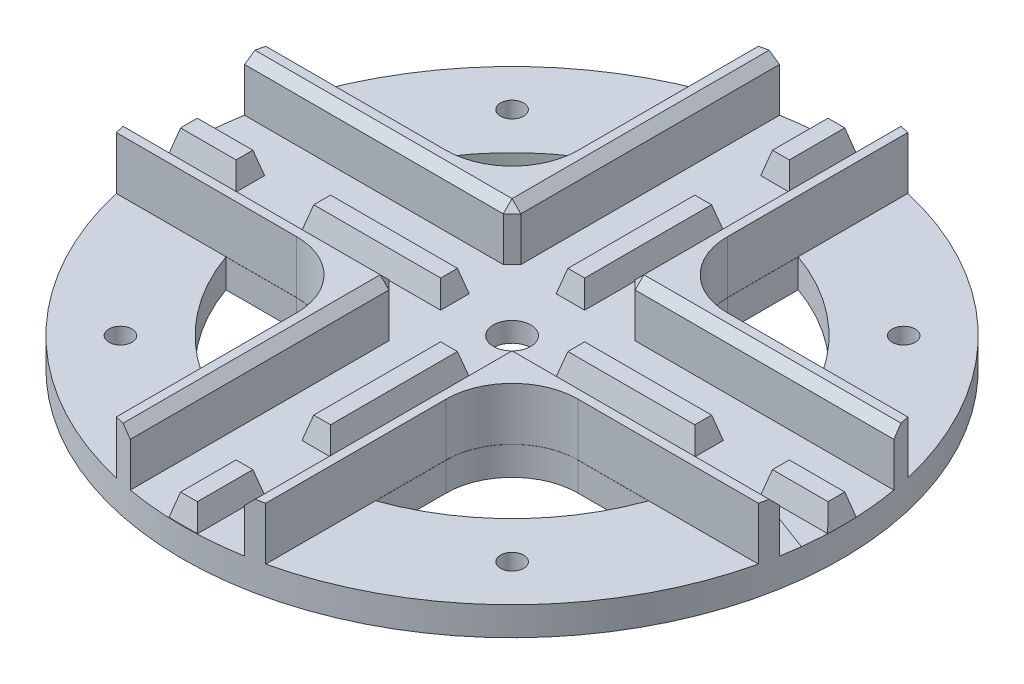
from build123d import *

# Parameters (mm, degrees)
SKETCH1_R                     = 75
SKETCH1_R_2                   = 4.25
BOSS_EXTRUDE1_DEPTH           = 6.5
BOSS_EXTRUDE2_DEPTH           = 12
CHAMFER1_SIZE                 = 2
CUT_EXTRUDE1_DEPTH            = 6.5
SKETCH4_R                     = 2.625
CUT_EXTRUDE2_DEPTH            = 6.5
SKETCH5_W                     = 31.547727215
SKETCH5_H                     = 6.5
BOSS_EXTRUDE3_DEPTH           = 5
BOSS_EXTRUDE3_DRAFT           = 15
BOSS_EXTRUDE3_PROFILE_2_DEPTH = 5
BOSS_EXTRUDE3_PROFILE_2_DRAFT = 15
SKETCH5_W_2                   = 6.5
SKETCH5_H_2                   = 31.547727215
BOSS_EXTRUDE3_PROFILE_3_DEPTH = 5
BOSS_EXTRUDE3_PROFILE_3_DRAFT = 15
BOSS_EXTRUDE3_PROFILE_4_DEPTH = 5
BOSS_EXTRUDE3_PROFILE_4_DRAFT = 15
BOSS_EXTRUDE3_PROFILE_5_DEPTH = 5
BOSS_EXTRUDE3_PROFILE_5_DRAFT = 15
BOSS_EXTRUDE3_PROFILE_6_DEPTH = 5
BOSS_EXTRUDE3_PROFILE_6_DRAFT = 15
BOSS_EXTRUDE3_PROFILE_7_DEPTH = 5
BOSS_EXTRUDE3_PROFILE_7_DRAFT = 15
BOSS_EXTRUDE3_PROFILE_8_DEPTH = 5
BOSS_EXTRUDE3_PROFILE_8_DRAFT = 15
SKETCH6_R                     = 12.125
CUT_EXTRUDE3_DEPTH            = 2


with BuildPart() as part:
    # Sketch1 → Boss-Extrude1 (new body)
    with BuildSketch(Plane(origin=(0, 0, 0), x_dir=(1, 0, 0), z_dir=(0, 1, 0))):
        with Locations(Location((0, 0, 0), (0, 0, 90))):
            Circle(SKETCH1_R)
        with Locations(Location((0, 0, 0), (0, 0, 90))):
            Circle(SKETCH1_R_2, mode=Mode.SUBTRACT)
    extrude(amount=BOSS_EXTRUDE1_DEPTH)

    # Sketch2 → Boss-Extrude2 (add)
    with BuildSketch(Plane(origin=(0, 6.5, 0), x_dir=(1, 0, 0), z_dir=(0, 1, 0))):
        with BuildLine():
            Line((-13, -13), (-73.86474125, -13))
            ThreePointArc((-73.86474125, -13), (-73.483557376, -15.005558816), (-73.047929471, -17))
            Line((-73.047929471, -17), (-32, -17))
            ThreePointArc((-32, -17), (-21.393398282, -21.393398282), (-17, -32))
            Line((-17, -32), (-17, -73.047929471))
            ThreePointArc((-17, -73.047929471), (-15.005558816, -73.483557376), (-13, -73.86474125))
            Line((-13, -73.86474125), (-13, -13))
        make_face()
        with BuildLine():
            Line((-32, 17), (-73.047929471, 17))
            ThreePointArc((-73.047929471, 17), (-73.483557376, 15.005558816), (-73.86474125, 13))
            Line((-73.86474125, 13), (-13, 13))
            Line((-13, 13), (-13, 73.86474125))
            ThreePointArc((-13, 73.86474125), (-15.005558816, 73.483557376), (-17, 73.047929471))
            Line((-17, 73.047929471), (-17, 32))
            ThreePointArc((-17, 32), (-21.393398282, 21.393398282), (-32, 17))
        make_face()
        with BuildLine():
            Line((17, 32), (17, 73.047929471))
            ThreePointArc((17, 73.047929471), (15.005558816, 73.483557376), (13, 73.86474125))
            Line((13, 73.86474125), (13, 13))
            Line((13, 13), (73.86474125, 13))
            ThreePointArc((73.86474125, 13), (73.483557376, 15.005558816), (73.047929471, 17))
            Line((73.047929471, 17), (32, 17))
            ThreePointArc((32, 17), (21.393398282, 21.393398282), (17, 32))
        make_face()
        with BuildLine():
            Line((32, -17), (73.047929471, -17))
            ThreePointArc((73.047929471, -17), (73.483557376, -15.005558816), (73.86474125, -13))
            Line((73.86474125, -13), (13, -13))
            Line((13, -13), (13, -73.86474125))
            ThreePointArc((13, -73.86474125), (15.005558816, -73.483557376), (17, -73.047929471))
            Line((17, -73.047929471), (17, -32))
            ThreePointArc((17, -32), (21.393398282, -21.393398282), (32, -17))
        make_face()
    extrude(amount=BOSS_EXTRUDE2_DEPTH)

    # Chamfer1
    chamfer1_edges = [part.edges().sort_by_distance(p)[0] for p in [
        (-13, 12.5, 13),
        (-13, 18.5, 43.432370625),
        (-43.432370625, 18.5, 13),
        (13, 12.5, 13),
        (43.432370625, 18.5, 13),
        (13, 18.5, 43.432370625),
        (-13, 12.5, -13),
        (-43.432370625, 18.5, -13),
        (-13, 18.5, -43.432370625),
        (13, 12.5, -13),
        (13, 18.5, -43.432370625),
        (43.432370625, 18.5, -13),
    ]]
    chamfer(chamfer1_edges, length=CHAMFER1_SIZE)

    # Sketch3 → Cut-Extrude1 (cut)
    with BuildSketch(Plane(origin=(0, 6.5, 0), x_dir=(1, 0, 0), z_dir=(0, 1, 0))):
        with BuildLine():
            Line((32.010408804, -17.027095026), (48.073672992, -17.027095026))
            ThreePointArc((48.073672992, -17.027095026), (36.062445841, -36.062445841), (17.027095026, -48.073672992))
            Line((17.027095026, -48.073672992), (17.027095026, -32.010408804))
            ThreePointArc((17.027095026, -32.010408804), (21.415606027, -21.415606027), (32.010408804, -17.027095026))
        make_face()
        with BuildLine():
            Line((-17.027095026, -32.010408804), (-17.027095026, -48.073672992))
            ThreePointArc((-17.027095026, -48.073672992), (-36.062445841, -36.062445841), (-48.073672992, -17.027095026))
            Line((-48.073672992, -17.027095026), (-32.010408804, -17.027095026))
            ThreePointArc((-32.010408804, -17.027095026), (-21.415606027, -21.415606027), (-17.027095026, -32.010408804))
        make_face()
        with BuildLine():
            Line((17.027095026, 32.010408804), (17.027095026, 48.073672992))
            ThreePointArc((17.027095026, 48.073672992), (36.062445841, 36.062445841), (48.073672992, 17.027095026))
            Line((48.073672992, 17.027095026), (32.010408804, 17.027095026))
            ThreePointArc((32.010408804, 17.027095026), (21.415606027, 21.415606027), (17.027095026, 32.010408804))
        make_face()
        with BuildLine():
            Line((-32.010408804, 17.027095026), (-48.073672992, 17.027095026))
            ThreePointArc((-48.073672992, 17.027095026), (-36.062445841, 36.062445841), (-17.027095026, 48.073672992))
            Line((-17.027095026, 48.073672992), (-17.027095026, 32.010408804))
            ThreePointArc((-17.027095026, 32.010408804), (-21.415606027, 21.415606027), (-32.010408804, 17.027095026))
        make_face()
    extrude(amount=-CUT_EXTRUDE1_DEPTH, mode=Mode.SUBTRACT)

    # Sketch4 → Cut-Extrude2 (cut)
    with BuildSketch(Plane(origin=(0, 6.5, 0), x_dir=(1, 0, 0), z_dir=(0, 1, 0))):
        with Locations(Location((44.547727215, -44.547727215, 0), (0, 0, 270))):
            Circle(SKETCH4_R)
        with Locations(Location((-44.547727215, -44.547727215, 0), (0, 0, 270))):
            Circle(SKETCH4_R)
        with Locations(Location((44.547727215, 44.547727215, 0), (0, 0, 270))):
            Circle(SKETCH4_R)
        with Locations(Location((-44.547727215, 44.547727215, 0), (0, 0, 270))):
            Circle(SKETCH4_R)
    extrude(amount=-CUT_EXTRUDE2_DEPTH, mode=Mode.SUBTRACT)


with BuildPart() as boss_extrude3_tool:
    # Sketch5 → Boss-Extrude3 (with draft: the straight prism first)
    with BuildSketch(Plane(origin=(0, 6.5, 0), x_dir=(1, 0, 0), z_dir=(0, 1, 0))):
        with Locations((-28.9100646, 0.136200992)):
            Rectangle(SKETCH5_W, SKETCH5_H)
    extrude(amount=BOSS_EXTRUDE3_DEPTH)
    # Boss-Extrude3: the draft: its side faces are tilted about the plane it starts from
    boss_extrude3_sides = [boss_extrude3_tool.faces().sort_by_distance(p)[0] for p in [
        (-44.683928207, 9, -0.136200992),
        (-28.910064599, 9, 3.113799008),
        (-13.136200992, 9, -0.136200992),
        (-28.910064599, 9, -3.386200992),
    ]]
    draft(boss_extrude3_sides, Plane(origin=(0, 6.5, 0), x_dir=(1, 0, 0), z_dir=(0, 1, 0)), BOSS_EXTRUDE3_DRAFT)


with BuildPart() as part_1:
    add(part.part)

    # Boss-Extrude3: add boss_extrude3_tool
    add(boss_extrude3_tool.part)


with BuildPart() as boss_extrude3_profile_2_tool:
    # Sketch5 → Boss-Extrude3 profile 2 (with draft: the straight prism first)
    with BuildSketch(Plane(origin=(0, 6.5, 0), x_dir=(1, 0, 0), z_dir=(0, 1, 0))):
        with BuildLine():
            ThreePointArc((-3.25, -74.793349254), (0, -74.863799008), (3.25, -74.793349254))
            Line((3.25, -74.793349254), (3.25, -59.547727215))
            Line((3.25, -59.547727215), (-3.25, -59.547727215))
            Line((-3.25, -59.547727215), (-3.25, -74.793349254))
        make_face()
    extrude(amount=BOSS_EXTRUDE3_PROFILE_2_DEPTH)
    # Boss-Extrude3 profile 2: the draft: its side faces are tilted about the plane it starts from
    boss_extrude3_profile_2_sides = [boss_extrude3_profile_2_tool.faces().sort_by_distance(p)[0] for p in [
        (0, 9, 74.863799008),
        (3.25, 9, 67.170538234),
        (0, 9, 59.547727215),
        (-3.25, 9, 67.170538234),
    ]]
    draft(boss_extrude3_profile_2_sides, Plane(origin=(0, 6.5, 0), x_dir=(1, 0, 0), z_dir=(0, 1, 0)), BOSS_EXTRUDE3_PROFILE_2_DRAFT)


with BuildPart() as part_2:
    add(part_1.part)

    # Boss-Extrude3 profile 2: add boss_extrude3_profile_2_tool
    add(boss_extrude3_profile_2_tool.part)


with BuildPart() as boss_extrude3_profile_3_tool:
    # Sketch5 → Boss-Extrude3 profile 3 (with draft: the straight prism first)
    with BuildSketch(Plane(origin=(0, 6.5, 0), x_dir=(1, 0, 0), z_dir=(0, 1, 0))):
        with Locations((0, -28.773863608)):
            Rectangle(SKETCH5_W_2, SKETCH5_H_2)
    extrude(amount=BOSS_EXTRUDE3_PROFILE_3_DEPTH)
    # Boss-Extrude3 profile 3: the draft: its side faces are tilted about the plane it starts from
    boss_extrude3_profile_3_sides = [boss_extrude3_profile_3_tool.faces().sort_by_distance(p)[0] for p in [
        (0, 9, 44.547727215),
        (3.25, 9, 28.773863607),
        (0, 9, 13),
        (-3.25, 9, 28.773863607),
    ]]
    draft(boss_extrude3_profile_3_sides, Plane(origin=(0, 6.5, 0), x_dir=(1, 0, 0), z_dir=(0, 1, 0)), BOSS_EXTRUDE3_PROFILE_3_DRAFT)


with BuildPart() as part_3:
    add(part_2.part)

    # Boss-Extrude3 profile 3: add boss_extrude3_profile_3_tool
    add(boss_extrude3_profile_3_tool.part)


with BuildPart() as boss_extrude3_profile_4_tool:
    # Sketch5 → Boss-Extrude3 profile 4 (with draft: the straight prism first)
    with BuildSketch(Plane(origin=(0, 6.5, 0), x_dir=(1, 0, 0), z_dir=(0, 1, 0))):
        with BuildLine():
            ThreePointArc((-74.929550246, 3.386200992), (-75, 0.136200992), (-74.929550246, -3.113799008))
            Line((-74.929550246, -3.113799008), (-59.683928207, -3.113799008))
            Line((-59.683928207, -3.113799008), (-59.683928207, 3.386200992))
            Line((-59.683928207, 3.386200992), (-74.929550246, 3.386200992))
        make_face()
    extrude(amount=BOSS_EXTRUDE3_PROFILE_4_DEPTH)
    # Boss-Extrude3 profile 4: the draft: its side faces are tilted about the plane it starts from
    boss_extrude3_profile_4_sides = [boss_extrude3_profile_4_tool.faces().sort_by_distance(p)[0] for p in [
        (-75, 9, -0.136200992),
        (-67.306739226, 9, 3.113799008),
        (-59.683928207, 9, -0.136200992),
        (-67.306739226, 9, -3.386200992),
    ]]
    draft(boss_extrude3_profile_4_sides, Plane(origin=(0, 6.5, 0), x_dir=(1, 0, 0), z_dir=(0, 1, 0)), BOSS_EXTRUDE3_PROFILE_4_DRAFT)


with BuildPart() as part_4:
    add(part_3.part)

    # Boss-Extrude3 profile 4: add boss_extrude3_profile_4_tool
    add(boss_extrude3_profile_4_tool.part)


with BuildPart() as boss_extrude3_profile_5_tool:
    # Sketch5 → Boss-Extrude3 profile 5 (with draft: the straight prism first)
    with BuildSketch(Plane(origin=(0, 6.5, 0), x_dir=(1, 0, 0), z_dir=(0, 1, 0))):
        with Locations((0, 29.046265591)):
            Rectangle(SKETCH5_W_2, SKETCH5_H_2)
    extrude(amount=BOSS_EXTRUDE3_PROFILE_5_DEPTH)
    # Boss-Extrude3 profile 5: the draft: its side faces are tilted about the plane it starts from
    boss_extrude3_profile_5_sides = [boss_extrude3_profile_5_tool.faces().sort_by_distance(p)[0] for p in [
        (0, 9, -44.820129199),
        (-3.25, 9, -29.046265591),
        (0, 9, -13.272401984),
        (3.25, 9, -29.046265591),
    ]]
    draft(boss_extrude3_profile_5_sides, Plane(origin=(0, 6.5, 0), x_dir=(1, 0, 0), z_dir=(0, 1, 0)), BOSS_EXTRUDE3_PROFILE_5_DRAFT)


with BuildPart() as part_5:
    add(part_4.part)

    # Boss-Extrude3 profile 5: add boss_extrude3_profile_5_tool
    add(boss_extrude3_profile_5_tool.part)


with BuildPart() as boss_extrude3_profile_6_tool:
    # Sketch5 → Boss-Extrude3 profile 6 (with draft: the straight prism first)
    with BuildSketch(Plane(origin=(0, 6.5, 0), x_dir=(1, 0, 0), z_dir=(0, 1, 0))):
        with BuildLine():
            ThreePointArc((3.25, 75.065751237), (0, 75.136200992), (-3.25, 75.065751237))
            Line((-3.25, 75.065751237), (-3.25, 59.820129199))
            Line((-3.25, 59.820129199), (3.25, 59.820129199))
            Line((3.25, 59.820129199), (3.25, 75.065751237))
        make_face()
    extrude(amount=BOSS_EXTRUDE3_PROFILE_6_DEPTH)
    # Boss-Extrude3 profile 6: the draft: its side faces are tilted about the plane it starts from
    boss_extrude3_profile_6_sides = [boss_extrude3_profile_6_tool.faces().sort_by_distance(p)[0] for p in [
        (0, 9, -75.136200992),
        (-3.25, 9, -67.442940218),
        (0, 9, -59.820129199),
        (3.25, 9, -67.442940218),
    ]]
    draft(boss_extrude3_profile_6_sides, Plane(origin=(0, 6.5, 0), x_dir=(1, 0, 0), z_dir=(0, 1, 0)), BOSS_EXTRUDE3_PROFILE_6_DRAFT)


with BuildPart() as part_6:
    add(part_5.part)

    # Boss-Extrude3 profile 6: add boss_extrude3_profile_6_tool
    add(boss_extrude3_profile_6_tool.part)


with BuildPart() as boss_extrude3_profile_7_tool:
    # Sketch5 → Boss-Extrude3 profile 7 (with draft: the straight prism first)
    with BuildSketch(Plane(origin=(0, 6.5, 0), x_dir=(1, 0, 0), z_dir=(0, 1, 0))):
        with Locations((28.9100646, 0.136200992)):
            Rectangle(SKETCH5_W, SKETCH5_H)
    extrude(amount=BOSS_EXTRUDE3_PROFILE_7_DEPTH)
    # Boss-Extrude3 profile 7: the draft: its side faces are tilted about the plane it starts from
    boss_extrude3_profile_7_sides = [boss_extrude3_profile_7_tool.faces().sort_by_distance(p)[0] for p in [
        (44.683928207, 9, -0.136200992),
        (28.910064599, 9, -3.386200992),
        (13.136200992, 9, -0.136200992),
        (28.910064599, 9, 3.113799008),
    ]]
    draft(boss_extrude3_profile_7_sides, Plane(origin=(0, 6.5, 0), x_dir=(1, 0, 0), z_dir=(0, 1, 0)), BOSS_EXTRUDE3_PROFILE_7_DRAFT)


with BuildPart() as part_7:
    add(part_6.part)

    # Boss-Extrude3 profile 7: add boss_extrude3_profile_7_tool
    add(boss_extrude3_profile_7_tool.part)


with BuildPart() as boss_extrude3_profile_8_tool:
    # Sketch5 → Boss-Extrude3 profile 8 (with draft: the straight prism first)
    with BuildSketch(Plane(origin=(0, 6.5, 0), x_dir=(1, 0, 0), z_dir=(0, 1, 0))):
        with BuildLine():
            ThreePointArc((74.929550246, -3.113799008), (75, 0.136200992), (74.929550246, 3.386200992))
            Line((74.929550246, 3.386200992), (59.683928207, 3.386200992))
            Line((59.683928207, 3.386200992), (59.683928207, -3.113799008))
            Line((59.683928207, -3.113799008), (74.929550246, -3.113799008))
        make_face()
    extrude(amount=BOSS_EXTRUDE3_PROFILE_8_DEPTH)
    # Boss-Extrude3 profile 8: the draft: its side faces are tilted about the plane it starts from
    boss_extrude3_profile_8_sides = [boss_extrude3_profile_8_tool.faces().sort_by_distance(p)[0] for p in [
        (75, 9, -0.136200992),
        (67.306739226, 9, -3.386200992),
        (59.683928207, 9, -0.136200992),
        (67.306739226, 9, 3.113799008),
    ]]
    draft(boss_extrude3_profile_8_sides, Plane(origin=(0, 6.5, 0), x_dir=(1, 0, 0), z_dir=(0, 1, 0)), BOSS_EXTRUDE3_PROFILE_8_DRAFT)


with BuildPart() as part_8:
    add(part_7.part)

    # Boss-Extrude3 profile 8: add boss_extrude3_profile_8_tool
    add(boss_extrude3_profile_8_tool.part)

    # Sketch6 → Cut-Extrude3 (cut)
    with BuildSketch(Plane.XZ):
        with Locations(Location((0, 0, 0), (0, 0, 270))):
            Circle(SKETCH6_R)
    extrude(amount=-CUT_EXTRUDE3_DEPTH, mode=Mode.SUBTRACT)


solid = part_8.part
